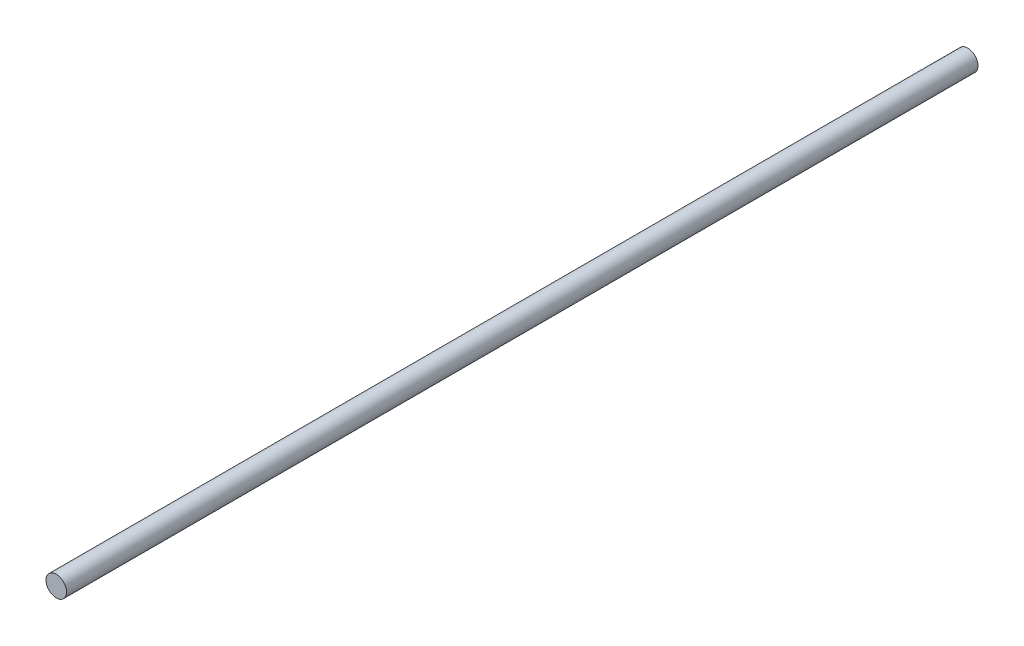
from build123d import *

# Parameters (mm, degrees)
SKETCH1_R           = 1.5
BOSS_EXTRUDE1_DEPTH = 133


with BuildPart() as part:
    # Sketch1 → Boss-Extrude1 (new body)
    with BuildSketch(Plane.XY):
        Circle(SKETCH1_R)
    extrude(amount=BOSS_EXTRUDE1_DEPTH)


solid = part.part
